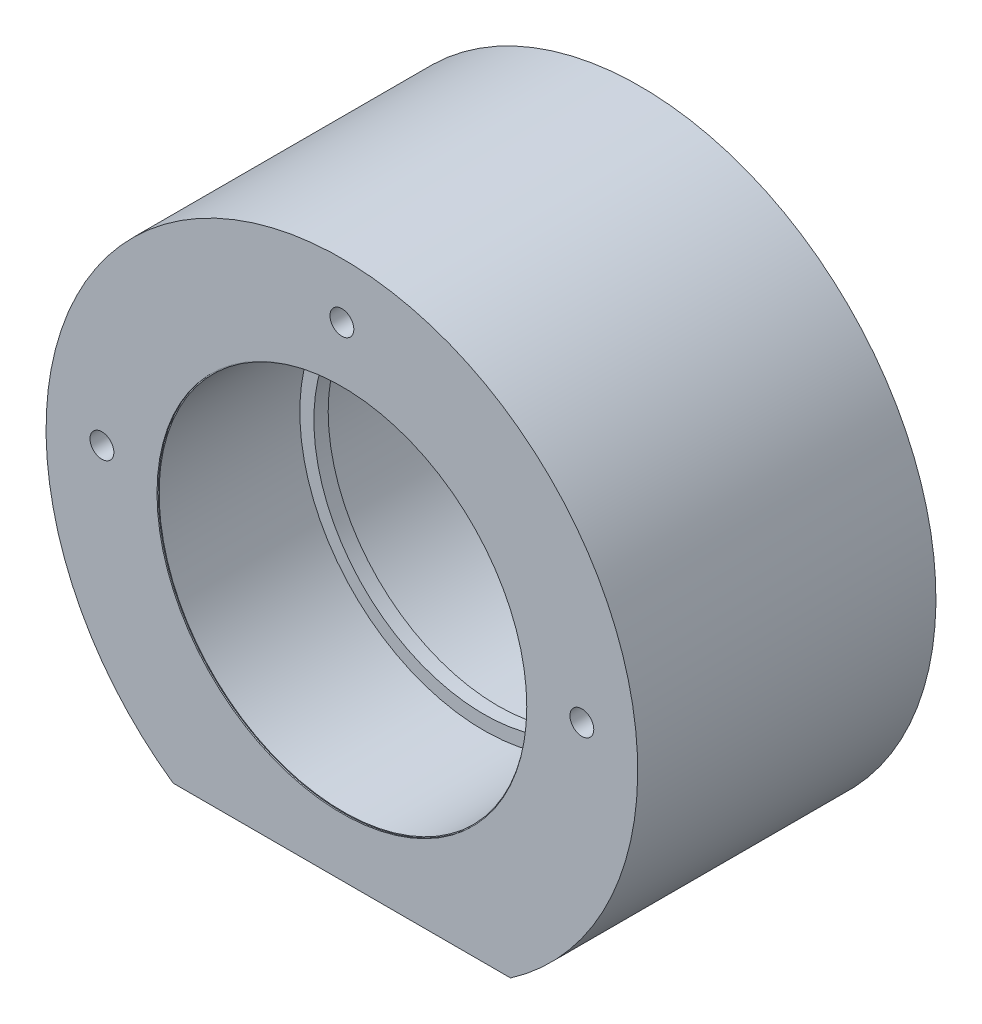
from build123d import *

# Parameters (mm, degrees)
SKETCH1_R           = 16.5
BOSS_EXTRUDE1_DEPTH = 50
SKETCH2_R           = 17.5
CUT_EXTRUDE1_DEPTH  = 11
SKETCH3_R           = 2
CUT_EXTRUDE2_DEPTH  = 10
SCALE1_SCALE        = 1.771428571
BOSS_EXTRUDE2_START = -49.599999988
SKETCH4_R           = 29.228571421
SKETCH4_R_2         = 28.498571422
BOSS_EXTRUDE2_DEPTH = 49.599999988
CUT_EXTRUDE6_START  = -44.285714
SKETCH6_R           = 28.498571422
CUT_EXTRUDE6_DEPTH  = 19.285
CUT_EXTRUDE7_START  = 50.000714
SKETCH7_R           = 28.498571422
CUT_EXTRUDE7_DEPTH  = 19.285
SKETCH9_R           = 30.85
CUT_EXTRUDE8_DEPTH  = 23.8
SKETCH10_R          = 2
CUT_EXTRUDE9_DEPTH  = 50.00142855


with BuildPart() as part:
    # Sketch1 → Boss-Extrude1 (new body)
    with BuildSketch(Plane.XY):
        with BuildLine():
            Line((-15.968719423, 0), (15.968719423, 0))
            ThreePointArc((15.968719423, 0), (0, 51), (-15.968719423, 0))
        make_face()
        with Locations((0, 23)):
            Circle(SKETCH1_R, mode=Mode.SUBTRACT)
    extrude(amount=BOSS_EXTRUDE1_DEPTH)

    # Sketch2 → Cut-Extrude1 (cut)
    with BuildSketch(Plane.XY.offset(50)):
        with Locations((0, 23)):
            Circle(SKETCH2_R)
    cut_extrude1 = extrude(amount=-CUT_EXTRUDE1_DEPTH, mode=Mode.SUBTRACT)

    # Mirror1: Cut-Extrude1 across plane
    add(cut_extrude1.mirror(Plane.XY.offset(25)), mode=Mode.SUBTRACT)

    # Sketch3 → Cut-Extrude2 (cut)
    with BuildSketch(Plane(origin=(0, 0, 0), x_dir=(-1, 0, 0), z_dir=(0, 0, -1))):
        with Locations((0, 45.5)):
            Circle(SKETCH3_R)
        with Locations((-22.5, 23)):
            Circle(SKETCH3_R)
        with Locations((22.5, 23)):
            Circle(SKETCH3_R)
    cut_extrude2 = extrude(amount=-CUT_EXTRUDE2_DEPTH, mode=Mode.SUBTRACT)

    # Mirror2: Cut-Extrude2 across plane
    add(cut_extrude2.mirror(Plane.XY.offset(25)), mode=Mode.SUBTRACT)


with BuildPart() as part_1:
    # Scale1: scaled about (0, 24.810283146, 25)
    add(part.part.scale(SCALE1_SCALE).moved(Location((0, -19.139361273, -19.285714275))))

    # Sketch4 → Boss-Extrude2 (add)
    with BuildSketch(Plane.XY.offset(49.799999994).offset(BOSS_EXTRUDE2_START)):
        with Locations((0, 21.60349586)):
            Circle(SKETCH4_R)
        with Locations((0, 21.60349586)):
            Circle(SKETCH4_R_2, mode=Mode.SUBTRACT)
    extrude(amount=BOSS_EXTRUDE2_DEPTH)

    # Sketch6 → Cut-Extrude6 (cut)
    with BuildSketch(Plane.XY.offset(25).offset(CUT_EXTRUDE6_START)):
        with BuildLine():
            Line((-28.287445828, -19.139361273), (28.287445828, -19.139361273))
            ThreePointArc((28.287445828, -19.139361273), (0, 71.203495848), (-28.287445828, -19.139361273))
        make_face()
        with Locations((0, 21.60349586)):
            Circle(SKETCH6_R, mode=Mode.SUBTRACT)
    extrude(amount=CUT_EXTRUDE6_DEPTH, mode=Mode.SUBTRACT)

    # Sketch7 → Cut-Extrude7 (cut)
    with BuildSketch(Plane.XY.offset(CUT_EXTRUDE7_START)):
        with BuildLine():
            Line((-28.287445828, -19.139361273), (28.287445828, -19.139361273))
            ThreePointArc((28.287445828, -19.139361273), (0, 71.203495848), (-28.287445828, -19.139361273))
        make_face()
        with Locations((0, 21.60349586)):
            Circle(SKETCH7_R, mode=Mode.SUBTRACT)
    extrude(amount=CUT_EXTRUDE7_DEPTH, mode=Mode.SUBTRACT)

    # Sketch9 → Cut-Extrude8 (cut)
    with BuildSketch(Plane.XY.offset(50.000714275)):
        with Locations((0, 21.60349586)):
            Circle(SKETCH9_R)
    cut_extrude8 = extrude(amount=-CUT_EXTRUDE8_DEPTH, mode=Mode.SUBTRACT)

    # Mirror3: Cut-Extrude8 across plane
    add(cut_extrude8.mirror(Plane.XY.offset(25)), mode=Mode.SUBTRACT)

    # Sketch10 → Cut-Extrude9 (cut)
    with BuildSketch(Plane.XY.offset(50.000714275)):
        with Locations((0, 61.90349586)):
            Circle(SKETCH10_R)
        with Locations((-40.233402491, 23.919381004)):
            Circle(SKETCH10_R)
        with Locations((40.233400771, 23.919410876)):
            Circle(SKETCH10_R)
    extrude(amount=-CUT_EXTRUDE9_DEPTH, mode=Mode.SUBTRACT)


solid = part_1.part
